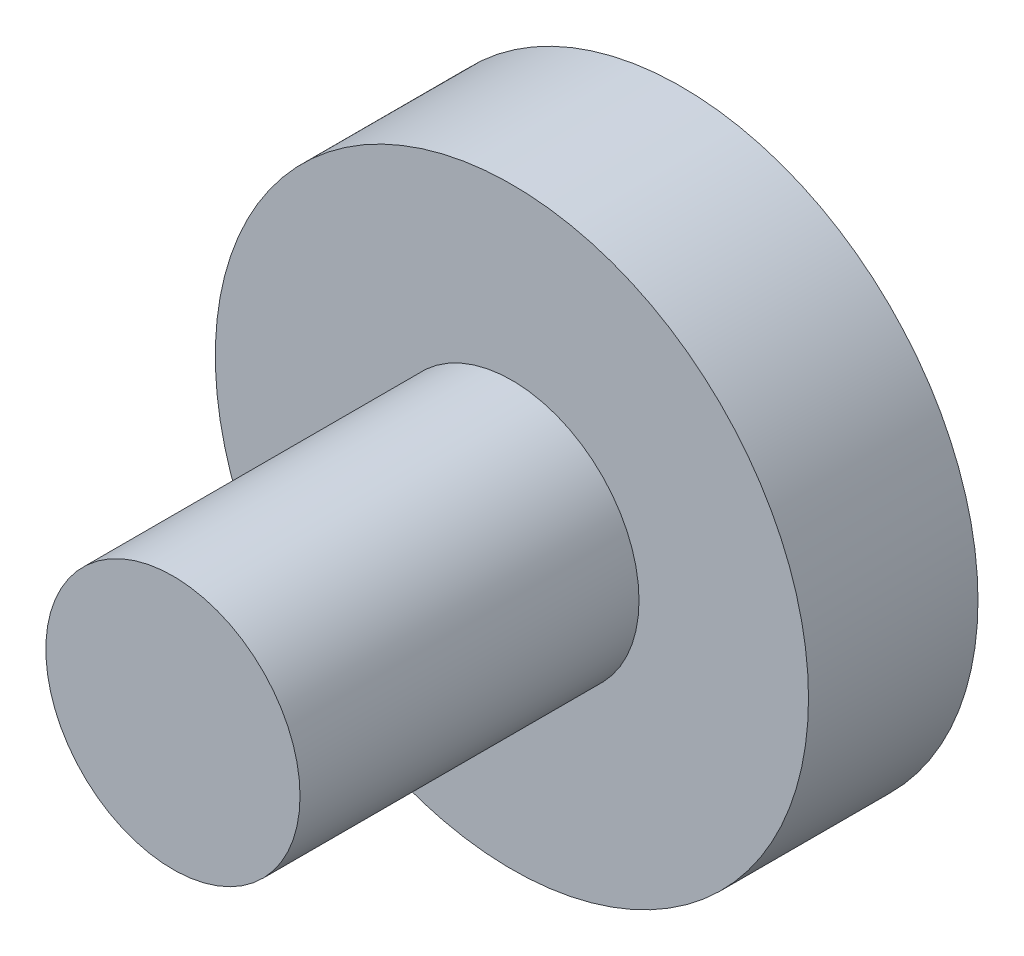
from build123d import *

# Parameters (mm, degrees)
SZKIC1_R                    = 3.5
DODANIE_WYCI_GNI_CIE1_DEPTH = 2
SZKIC2_R                    = 1.5
DODANIE_WYCI_GNI_CIE2_DEPTH = 4


with BuildPart() as part:
    # Szkic1 → Dodanie-wyciągnięcie1 (new body)
    with BuildSketch(Plane.XY):
        Circle(SZKIC1_R)
    extrude(amount=DODANIE_WYCI_GNI_CIE1_DEPTH)

    # Szkic2 → Dodanie-wyciągnięcie2 (add)
    with BuildSketch(Plane.XY.offset(2)):
        Circle(SZKIC2_R)
    extrude(amount=DODANIE_WYCI_GNI_CIE2_DEPTH)


solid = part.part
